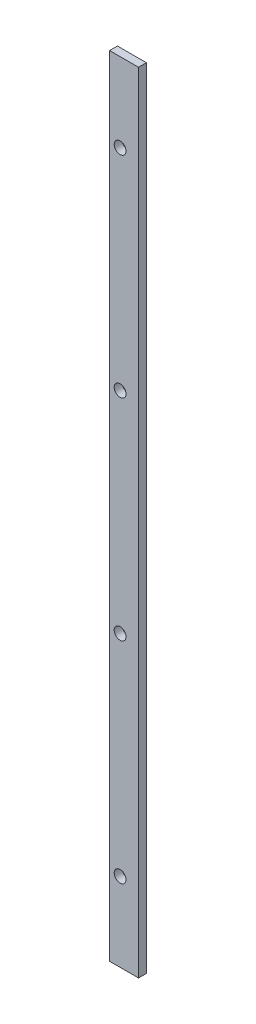
from build123d import *

# Parameters (mm, degrees)
ESQUISSE1_W             = 8
ESQUISSE1_H             = 300
BOSS_EXTRU_1_DEPTH      = 3
ESQUISSE2_R             = 2.25
ENL_V_MAT_EXTRU_1_DEPTH = 301.121642005
ESQUISSE4_W             = 3
ESQUISSE4_H             = 300
BOSS_EXTRU_2_DEPTH      = 3


with BuildPart() as part:
    # Esquisse1 → Boss.-Extru.1 (new body)
    with BuildSketch(Plane.XY):
        with Locations((4, 150)):
            Rectangle(ESQUISSE1_W, ESQUISSE1_H)
    extrude(amount=BOSS_EXTRU_1_DEPTH)

    # Esquisse2 → Enlèv. mat.-Extru.1 (cut, through all)
    with BuildSketch(Plane.XY.offset(3)):
        with Locations((4, 110)):
            Circle(ESQUISSE2_R)
        with Locations((4, 30)):
            Circle(ESQUISSE2_R)
        with Locations(Location((4, 270, 0), (0, 0, 180))):
            Circle(ESQUISSE2_R)
        with Locations(Location((4, 190, 0), (0, 0, 180))):
            Circle(ESQUISSE2_R)
    extrude(amount=-ENL_V_MAT_EXTRU_1_DEPTH, mode=Mode.SUBTRACT)

    # Esquisse4 → Boss.-Extru.2 (add)
    with BuildSketch(Plane.XY.offset(3)):
        with Locations((9.5, 150)):
            Rectangle(ESQUISSE4_W, ESQUISSE4_H)
    extrude(amount=-BOSS_EXTRU_2_DEPTH)


solid = part.part
